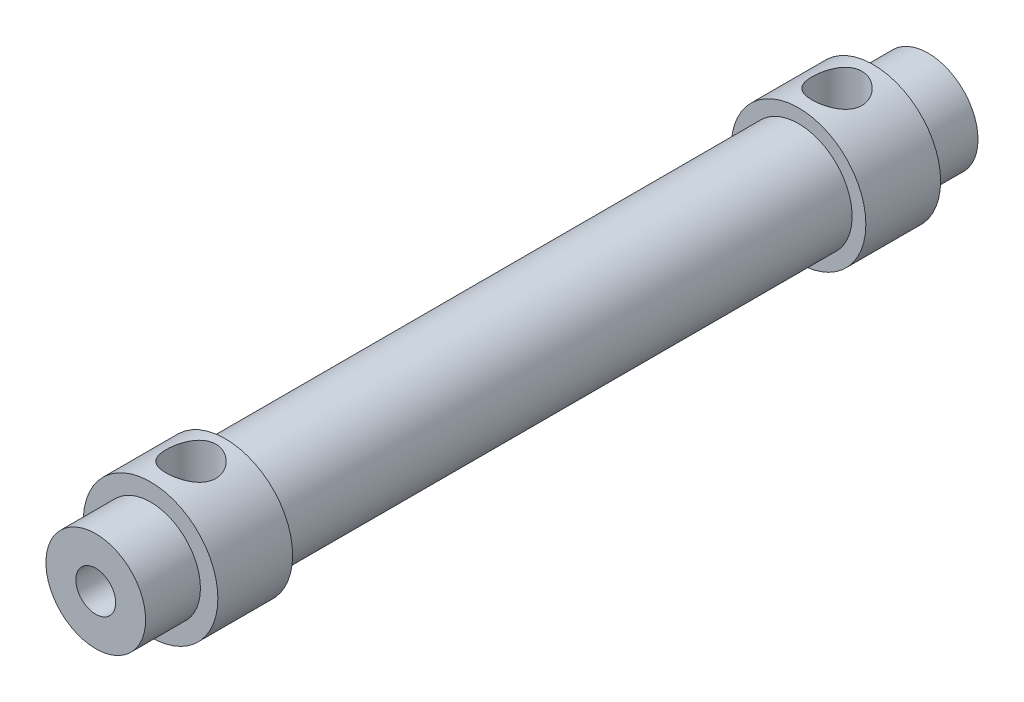
from build123d import *

# Parameters (mm, degrees)
SKETCH_1_R          = 10.75
SKETCH_1_R_2        = 9
EXTRUDE_1_DEPTH     = 115
SKETCH_2_R          = 13.5
EXTRUDE_2_DEPTH     = 15
SKETCH_3_R          = 10
EXTRUDE_3_DEPTH     = 11
SKETCH_4_R          = 4
CUT_EXTRUDE_4_DEPTH = 143.286682441
SKETCH_5_R          = 5
CUT_EXTRUDE_5_DEPTH = 15


with BuildPart() as part:
    # 草图1 → 拉伸1 (new body)
    with BuildSketch(Plane.XY):
        Circle(SKETCH_1_R)
        Circle(SKETCH_1_R_2, mode=Mode.SUBTRACT)
    extrude(amount=EXTRUDE_1_DEPTH)

    # 草图2 → 拉伸2 (add)
    with BuildSketch(Plane.XY.offset(115)):
        Circle(SKETCH_2_R)
    extrude_2 = extrude(amount=EXTRUDE_2_DEPTH)

    # 草图3 → 拉伸3 (add)
    with BuildSketch(Plane.XY.offset(130)):
        Circle(SKETCH_3_R)
    extrude_3 = extrude(amount=EXTRUDE_3_DEPTH)

    # 草图4 → 拉伸4 (cut, through all)
    with BuildSketch(Plane.XY.offset(141)):
        Circle(SKETCH_4_R)
    cut_extrude_4 = extrude(amount=-CUT_EXTRUDE_4_DEPTH, mode=Mode.SUBTRACT)

    # 镜向2: 拉伸2, 拉伸3, 拉伸4 across plane
    add(extrude_2.mirror(Plane(origin=(0, 0, 57.5), x_dir=(1, 0, 0), z_dir=(0, 0, -1))))
    add(extrude_3.mirror(Plane(origin=(0, 0, 57.5), x_dir=(1, 0, 0), z_dir=(0, 0, -1))))
    add(cut_extrude_4.mirror(Plane(origin=(0, 0, 57.5), x_dir=(1, 0, 0), z_dir=(0, 0, -1))), mode=Mode.SUBTRACT)

    # 草图5 → 拉伸5 (cut)
    with BuildSketch(Plane(origin=(0, 13.5, 0), x_dir=(-1, 0, 0), z_dir=(0, 1, 0))):
        with Locations(Location((0, 121.892959872, 0), (0, 0, 90))):
            Circle(SKETCH_5_R)
        with Locations(Location((0, -7.708924082, 0), (0, 0, 90))):
            Circle(SKETCH_5_R)
    extrude(amount=-CUT_EXTRUDE_5_DEPTH, mode=Mode.SUBTRACT)


solid = part.part
